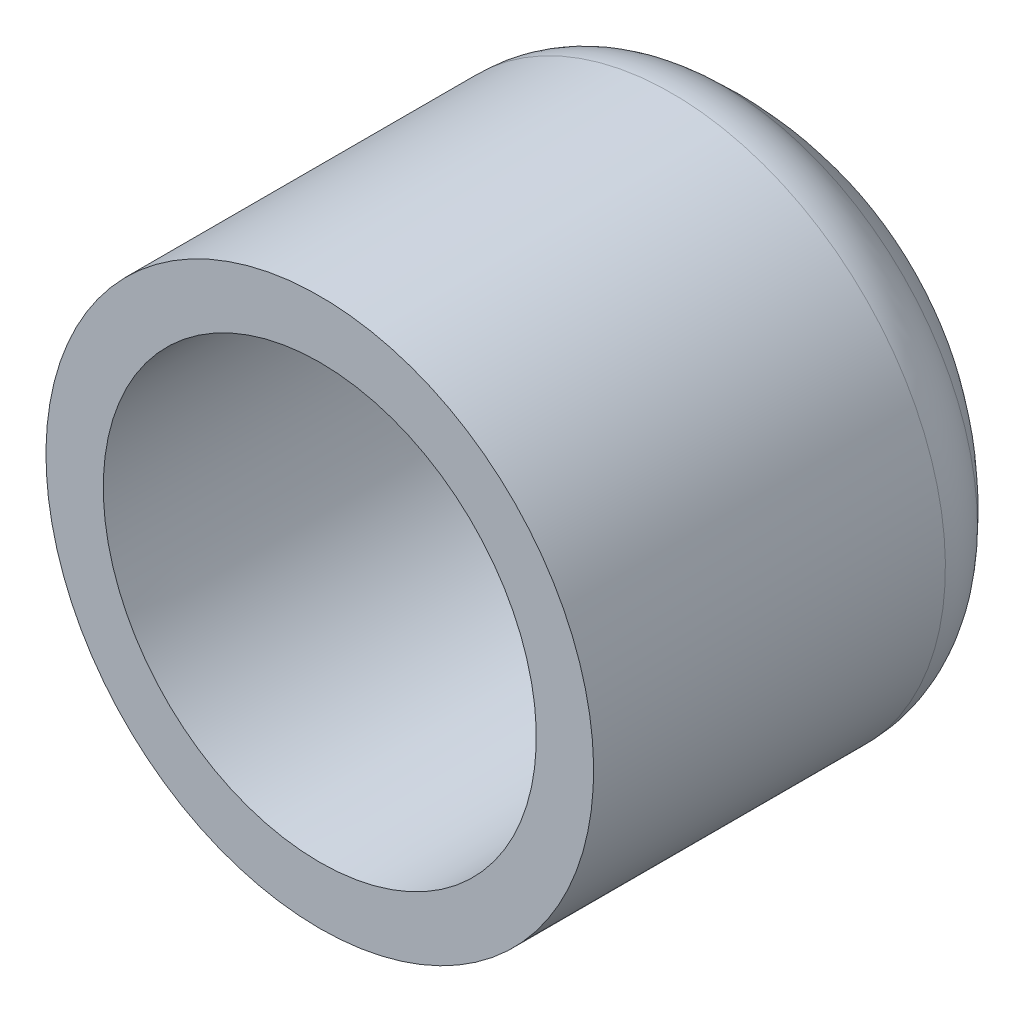
from build123d import *

# Parameters (mm, degrees)
FILLET1_R = 4.826


with BuildPart() as part:
    # Sketch2 → Revolve1 (revolve)
    with BuildSketch(Plane(origin=(0, 0, 0), x_dir=(0, 0, -1), z_dir=(1, 0, 0))):
        with BuildLine():
            Line((-16.0401, -13.4366), (-16.0401, -16.9926))
            Line((-16.0401, -16.9926), (7.50547048, -16.9926))
            ThreePointArc((7.50547048, -16.9926), (13.786577126, -9.507738372), (16.0401, 0))
            Line((16.0401, 0), (12.0523, 0))
            ThreePointArc((12.0523, 0), (10.999645869, -5.924050901), (7.970561543, -11.122811132))
            ThreePointArc((7.970561543, -11.122811132), (6.613783182, -12.155372908), (4.948709843, -12.5222))
            Line((4.948709843, -12.5222), (4.2799, -12.5222))
            Line((4.2799, -12.5222), (4.2799, -13.2842))
            Line((4.2799, -13.2842), (-16.0401, -13.4366))
        make_face()
    revolve(axis=Axis((0, 0, 16.0401), (0, 0, -1)))

    # Fillet1
    fillet1_edges = [part.edges().sort_by_distance(p)[0] for p in [
        (0, 16.9926, -7.50547048),
    ]]
    fillet(fillet1_edges, radius=FILLET1_R)


solid = part.part
